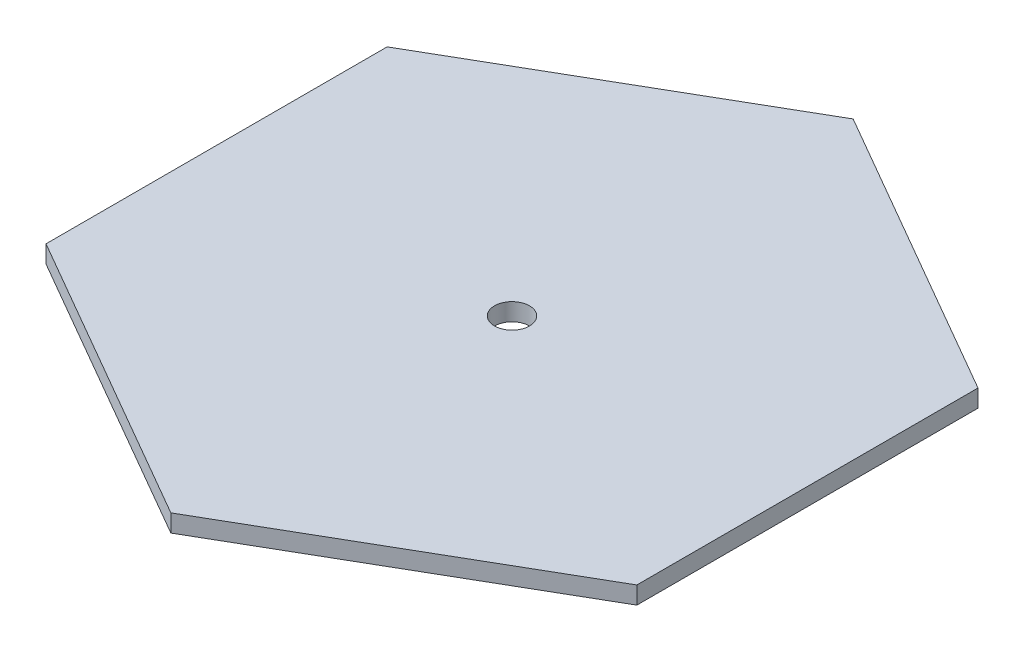
from build123d import *

# Parameters (mm, degrees)
BOSS_EXTRUDE1_DEPTH = 2
CUT_EXTRUDE1_REACH  = 53.631
SKETCH2_R           = 2


with BuildPart() as part:
    # Sketch1 → Boss-Extrude1 (new body)
    with BuildSketch(Plane(origin=(0, 0, 0), x_dir=(1, 0, 0), z_dir=(0, 1, 0))):
        Polygon((33.774990748, 19.5), (0, 39), (-33.774990748, 19.5), (-33.774990748, -19.5), (0, -39), (33.774990748, -19.5), align=None)
    extrude(amount=BOSS_EXTRUDE1_DEPTH)

    # Sketch2 → Cut-Extrude1 (cut, up to next)
    with BuildSketch(Plane(origin=(0, 2, 0), x_dir=(1, 0, 0), z_dir=(0, 1, 0)), mode=Mode.PRIVATE) as cut_extrude1_sk1:
        with Locations(Location((0, 0, 0), (0, 0, 270))):
            Circle(SKETCH2_R)
    cut_extrude1_tool1 = extrude(cut_extrude1_sk1.sketch, amount=-CUT_EXTRUDE1_REACH, mode=Mode.PRIVATE) & part.part
    add(cut_extrude1_tool1.solids().sort_by_distance((0, 2, 0))[0], mode=Mode.SUBTRACT)


solid = part.part
